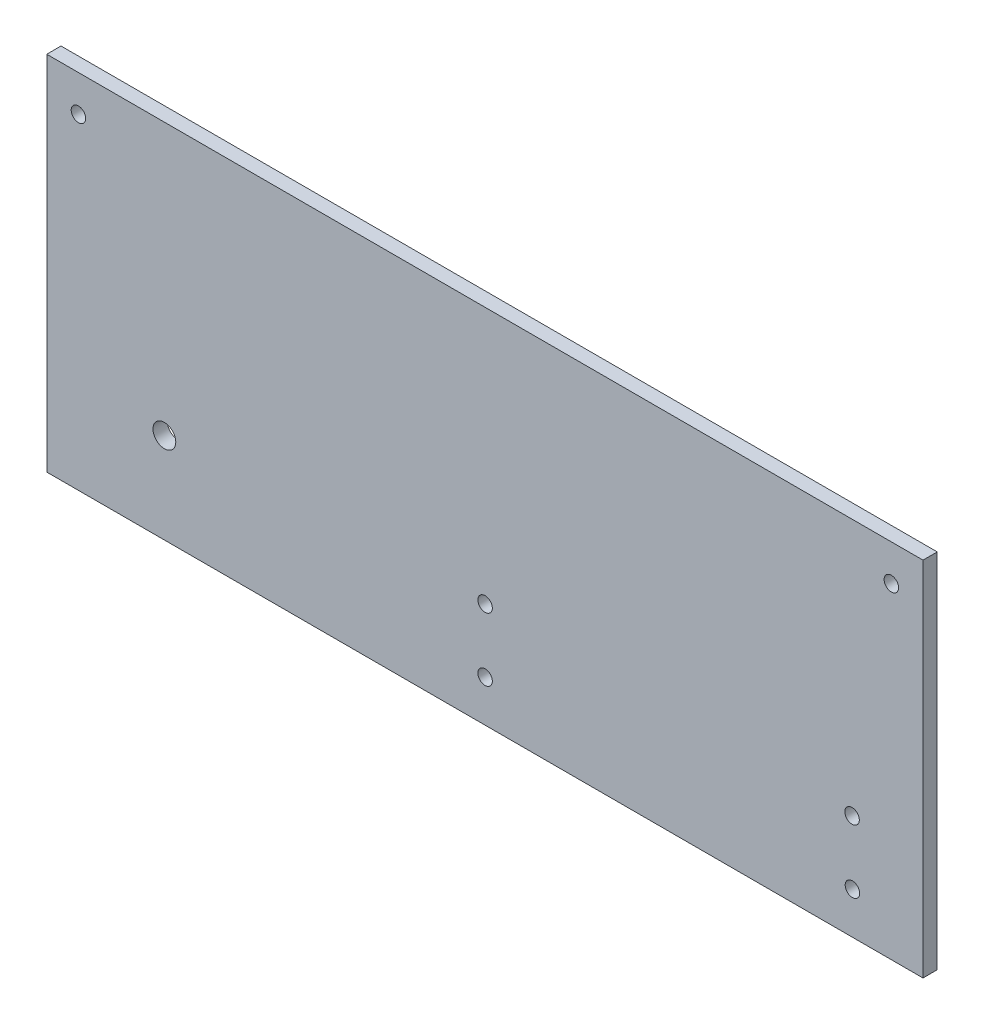
from build123d import *

# Parameters (mm, degrees)
SKETCH1_W           = 246
SKETCH1_H           = 101.6
SKETCH1_R           = 2.032
SKETCH1_R_2         = 3.2004
BOSS_EXTRUDE1_DEPTH = 4


with BuildPart() as part:
    # Sketch1 → Boss-Extrude1 (new body)
    with BuildSketch(Plane.XY):
        with Locations((127, 50.8)):
            Rectangle(SKETCH1_W, SKETCH1_H)
        with Locations((127.063, 29.464)):
            Circle(SKETCH1_R, mode=Mode.SUBTRACT)
        with Locations((127.063, 11.684)):
            Circle(SKETCH1_R, mode=Mode.SUBTRACT)
        with Locations((37.02, 25.4)):
            Circle(SKETCH1_R_2, mode=Mode.SUBTRACT)
        with Locations((230.0864, 29.464)):
            Circle(SKETCH1_R, mode=Mode.SUBTRACT)
        with Locations((230.188, 11.684)):
            Circle(SKETCH1_R, mode=Mode.SUBTRACT)
        with Locations((12.89, 91.44)):
            Circle(SKETCH1_R, mode=Mode.SUBTRACT)
        with Locations((241.11, 91.44)):
            Circle(SKETCH1_R, mode=Mode.SUBTRACT)
    extrude(amount=BOSS_EXTRUDE1_DEPTH)


solid = part.part
